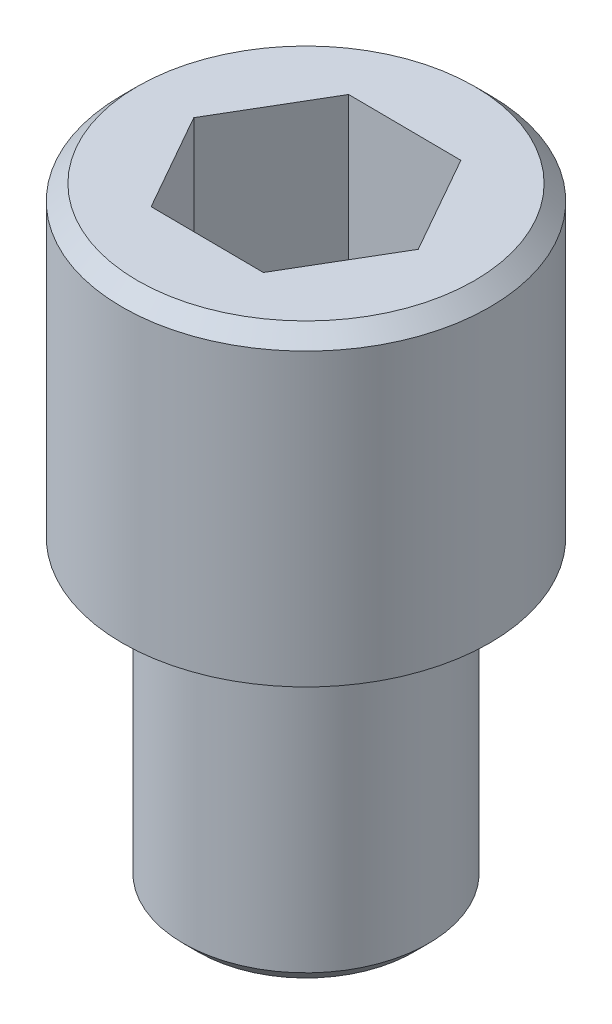
from build123d import *

# Parameters (mm, degrees)
SKICA1_R                 = 2
P_IDAT_VYSUNUT_M1_DEPTH  = 5
SKICA2_R                 = 3
P_IDAT_VYSUNUT_M2_DEPTH  = 5
ODEBRAT_VYSUNUT_M1_DEPTH = 3
ZKOSEN_1_SIZE            = 0.25


with BuildPart() as part:
    # Skica1 → Přidat vysunutím1 (new body)
    with BuildSketch(Plane(origin=(0, 0, 0), x_dir=(1, 0, 0), z_dir=(0, 1, 0))):
        with Locations(Location((0, 0, 0), (0, 0, 270))):
            Circle(SKICA1_R)
    extrude(amount=P_IDAT_VYSUNUT_M1_DEPTH)

    # Skica2 → Přidat vysunutím2 (add)
    with BuildSketch(Plane(origin=(0, 5, 0), x_dir=(1, 0, 0), z_dir=(0, 1, 0))):
        with Locations(Location((0, 0, 0), (0, 0, 270))):
            Circle(SKICA2_R)
    extrude(amount=P_IDAT_VYSUNUT_M2_DEPTH)

    # Skica3 → Odebrat vysunutím1 (cut)
    with BuildSketch(Plane(origin=(0, 10, 0), x_dir=(1, 0, 0), z_dir=(0, 1, 0))):
        Polygon((-0.93651815, -1.592566196), (0.910943707, -1.607331607), (1.847461858, -0.014765412), (0.93651815, 1.592566196), (-0.910943707, 1.607331607), (-1.847461858, 0.014765412), align=None)
    extrude(amount=-ODEBRAT_VYSUNUT_M1_DEPTH, mode=Mode.SUBTRACT)

    # Zkosení1
    zkosen_1_edges = [part.edges().sort_by_distance(p)[0] for p in [
        (0, 0, -2),
        (0, 10, -3),
    ]]
    chamfer(zkosen_1_edges, length=ZKOSEN_1_SIZE)


solid = part.part
